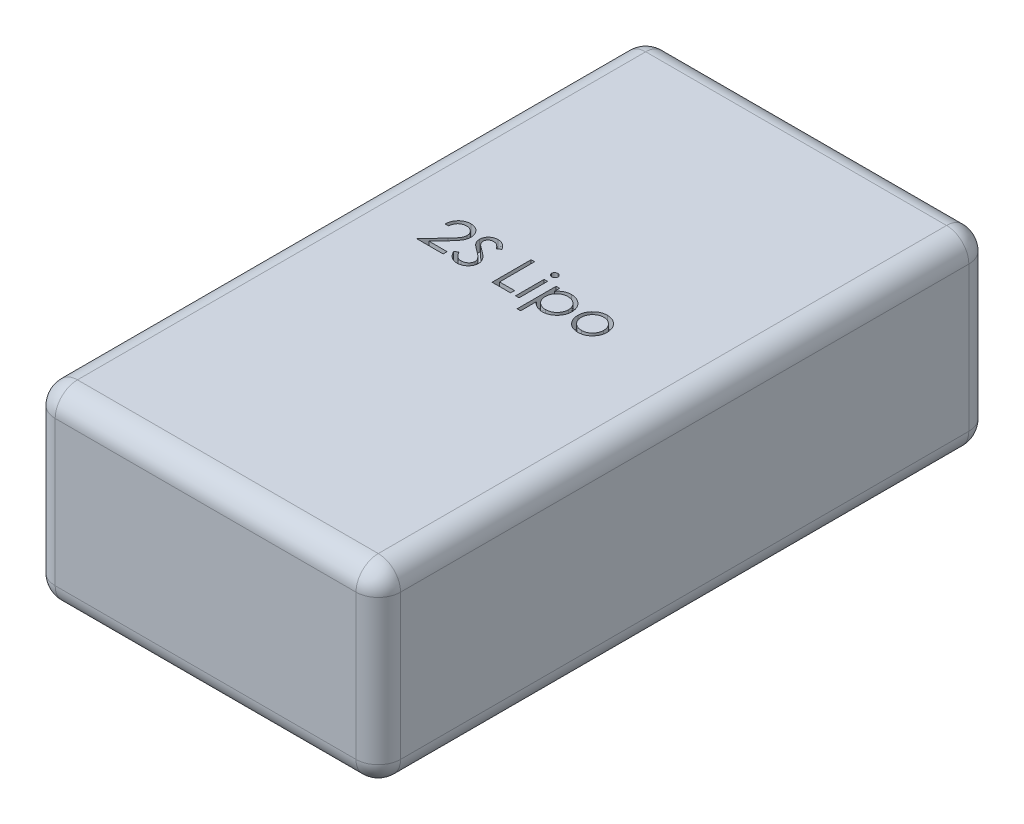
from build123d import *

# Parameters (mm, degrees)
SKETCH1_W           = 31
SKETCH1_H           = 55
BOSS_EXTRUDE1_DEPTH = 17
SKETCH2_W           = 0.314102564
SKETCH2_H           = 2.557692308
CUT_EXTRUDE1_DEPTH  = 1
FILLET1_R           = 2


with BuildPart() as part:
    # Sketch1 → Boss-Extrude1 (new body)
    with BuildSketch(Plane(origin=(0, 0, 0), x_dir=(1, 0, 0), z_dir=(0, 1, 0))):
        with Locations((15.5, -27.5)):
            Rectangle(SKETCH1_W, SKETCH1_H)
    extrude(amount=BOSS_EXTRUDE1_DEPTH)

    # Sketch2 → Cut-Extrude1 (cut)
    # profile 1 of 7: a face of its own
    with BuildSketch(Plane(origin=(0, 17, 0), x_dir=(1, 0, 0), z_dir=(0, 1, 0))):
        with BuildLine():
            Line((6.692234496, -24.382132974), (6.378131932, -24.382132974))
            add(Edge.make_bspline(
                [(6.378131932, -24.382132974), (6.380179085, -24.340462086), (6.384199639, -24.258621572), (6.403027928, -24.139297665), (6.429968806, -24.025242866), (6.46806026, -23.917372952), (6.515366537, -23.814734145), (6.572096565, -23.71773413), (6.639290415, -23.626742941), (6.715497149, -23.542604098), (6.798265788, -23.465416527), (6.887571728, -23.398761284), (6.981416755, -23.342443613), (7.079516154, -23.295362371), (7.182976718, -23.260022525), (7.290859576, -23.233800885), (7.403638712, -23.218024539), (7.480478734, -23.216328754), (7.519558214, -23.215466307)],
                knots=[0, 0, 0, 0, 1.10065271, 2.161652631, 3.183658789, 4.190468796, 5.17591951, 6.163126047, 7.15150782, 8.156236427, 9.156009102, 10.134482811, 11.092018607, 12.041330605, 13.001268258, 13.972401359, 14.968799086, 16, 16, 16, 16], degree=3))
            add(Edge.make_bspline(
                [(7.519558214, -23.215466307), (7.557936288, -23.216364764), (7.633347833, -23.218130198), (7.743409847, -23.233291228), (7.848187142, -23.257036819), (7.947474908, -23.290352236), (8.040480973, -23.335136663), (8.127904017, -23.388934202), (8.210784828, -23.451154033), (8.285391612, -23.524407847), (8.353899691, -23.602610231), (8.413001946, -23.686098135), (8.46361511, -23.77232742), (8.50580279, -23.861955622), (8.536858929, -23.95582665), (8.560437137, -24.052573853), (8.57376455, -24.153198664), (8.575809974, -24.22130522), (8.576849881, -24.255931051)],
                knots=[0, 0, 0, 0, 1.111607364, 2.184268762, 3.212621178, 4.221274766, 5.211760367, 6.196651075, 7.1921475, 8.207485113, 9.220403448, 10.201281604, 11.166441695, 12.114753415, 13.065576456, 14.026450734, 14.996634279, 16, 16, 16, 16], degree=3))
            add(Edge.make_bspline(
                [(8.576849881, -24.255931051), (8.575156618, -24.304678885), (8.571799807, -24.401319099), (8.54308543, -24.543333962), (8.498238919, -24.680927381), (8.444241562, -24.791664683), (8.389769118, -24.880898177), (8.34068161, -24.954366882), (8.283216799, -25.03347235), (8.216538301, -25.117949687), (8.142025429, -25.208460593), (8.059003266, -25.304950388), (7.966879784, -25.406422158), (7.902221283, -25.475727759), (7.868716868, -25.511640185)],
                knots=[0, 0, 0, 0, 1.184426356, 2.348067706, 3.509069118, 4.696110526, 5.333549288, 6.050745305, 6.844228056, 7.710549037, 8.667450064, 9.695053472, 10.805634456, 12, 12, 12, 12], degree=3))
            Line((7.868716868, -25.511640185), (6.993015746, -26.446235538))
            Line((6.993015746, -26.446235538), (8.621721676, -26.446235538))
            Line((8.621721676, -26.446235538), (8.621721676, -26.805209897))
            Line((8.621721676, -26.805209897), (6.243516548, -26.805209897))
            Line((6.243516548, -26.805209897), (7.600888342, -25.356692269))
            add(Edge.make_bspline(
                [(7.600888342, -25.356692269), (7.633936229, -25.322193962), (7.697414456, -25.255929776), (7.787197033, -25.159186815), (7.867836021, -25.069437275), (7.939853414, -24.986850726), (8.00168692, -24.910219158), (8.056559152, -24.842024455), (8.100524742, -24.779270005), (8.148240138, -24.706529391), (8.19445412, -24.617717073), (8.234166476, -24.509183384), (8.258381324, -24.397456132), (8.26128616, -24.321954095), (8.262747317, -24.283975923)],
                knots=[0, 0, 0, 0, 1.329631726, 2.553950428, 3.673215718, 4.687767853, 5.603093632, 6.413772471, 7.123043292, 7.734684054, 8.834405432, 9.900288307, 10.943827018, 12, 12, 12, 12], degree=3))
            add(Edge.make_bspline(
                [(8.262747317, -24.283975923), (8.262111574, -24.260094524), (8.260858648, -24.213028874), (8.249800951, -24.144023115), (8.233090445, -24.077458301), (8.209145187, -24.013129682), (8.177538447, -23.95168403), (8.139065067, -23.89304655), (8.094675003, -23.836357584), (8.043323734, -23.783204286), (7.986912214, -23.734523081), (7.927317965, -23.691398995), (7.86426786, -23.655359885), (7.798027738, -23.625816387), (7.728782269, -23.602641006), (7.656397524, -23.586582427), (7.581073507, -23.576499943), (7.529640012, -23.575135771), (7.503432413, -23.574440666)],
                knots=[0, 0, 0, 0, 0.991446411, 1.95395049, 2.89581595, 3.838931463, 4.798493298, 5.75982156, 6.748411868, 7.785213223, 8.824556874, 9.840280684, 10.836137867, 11.835679398, 12.848801643, 13.863922112, 14.911575587, 16, 16, 16, 16], degree=3))
            add(Edge.make_bspline(
                [(7.503432413, -23.574440666), (7.47606158, -23.575155698), (7.422309784, -23.576559904), (7.343390751, -23.586382568), (7.268104973, -23.603328408), (7.196263071, -23.626505083), (7.127743485, -23.655963631), (7.062879441, -23.692655376), (7.001816551, -23.736438869), (6.944440028, -23.786079426), (6.891576049, -23.841347027), (6.845129173, -23.90295699), (6.804545159, -23.969784405), (6.769135925, -24.041648956), (6.740380235, -24.119202736), (6.718407085, -24.202170441), (6.701020238, -24.290191822), (6.695211718, -24.350976907), (6.692234496, -24.382132974)],
                knots=[0, 0, 0, 0, 1.031018746, 2.02475058, 2.990194455, 3.934040569, 4.864654155, 5.795059489, 6.735614925, 7.690564532, 8.649604399, 9.611025574, 10.590972636, 11.591080095, 12.624614302, 13.701020113, 14.821632451, 16, 16, 16, 16], degree=3))
        make_face()
    # profile 2 of 7: a face of its own
    with BuildSketch(Plane(origin=(0, 17, 0), x_dir=(1, 0, 0), z_dir=(0, 1, 0))):
        with BuildLine():
            Line((8.890952445, -26.130029609), (9.186825842, -25.952645794))
            add(Edge.make_bspline(
                [(9.186825842, -25.952645794), (9.21434408, -25.998710179), (9.26706796, -26.086967763), (9.355019319, -26.206225804), (9.446152231, -26.30758796), (9.541141564, -26.390464568), (9.639407512, -26.455713455), (9.741591566, -26.501915686), (9.847349377, -26.530731662), (9.919323198, -26.534231748), (9.95525533, -26.535979128)],
                knots=[0, 0, 0, 0, 1.272034388, 2.437168799, 3.508375237, 4.49857839, 5.41946034, 6.295179144, 7.148887113, 8, 8, 8, 8], degree=3))
            add(Edge.make_bspline(
                [(9.95525533, -26.535979128), (9.98594219, -26.535124455), (10.046778963, -26.533430065), (10.136341206, -26.517149263), (10.223323008, -26.492137134), (10.305931646, -26.456316202), (10.383027261, -26.412977717), (10.450633956, -26.360631539), (10.509080069, -26.302025334), (10.556889184, -26.236642679), (10.593569219, -26.16632553), (10.621761287, -26.094149579), (10.637406361, -26.018981011), (10.639763115, -25.968370548), (10.640952445, -25.942830089)],
                knots=[0, 0, 0, 0, 1.095163259, 2.171163733, 3.241058638, 4.321873601, 5.38011039, 6.391990106, 7.366004449, 8.327778327, 9.272591725, 10.192022065, 11.087607919, 12, 12, 12, 12], degree=3))
            add(Edge.make_bspline(
                [(10.640952445, -25.942830089), (10.639478134, -25.91368924), (10.636481076, -25.85445015), (10.611149596, -25.767050497), (10.571300349, -25.680557927), (10.534537705, -25.627056662), (10.515451644, -25.59928041)],
                knots=[0, 0, 0, 0, 0.938893495, 1.908633276, 2.914225137, 4, 4, 4, 4], degree=3))
            add(Edge.make_bspline(
                [(10.515451644, -25.59928041), (10.499781029, -25.579233586), (10.466882535, -25.537147788), (10.410325023, -25.474502552), (10.343958908, -25.409884133), (10.270055353, -25.340825076), (10.185922265, -25.27053728), (10.09419475, -25.195669002), (9.992530891, -25.119067425), (9.921231395, -25.067694859), (9.884442028, -25.041187461)],
                knots=[0, 0, 0, 0, 0.722233717, 1.516239348, 2.393582979, 3.351407094, 4.387010283, 5.505090956, 6.712668013, 8, 8, 8, 8], degree=3))
            add(Edge.make_bspline(
                [(9.884442028, -25.041187461), (9.847618032, -25.014958873), (9.777213356, -24.964811811), (9.678754773, -24.890387527), (9.59071031, -24.822343658), (9.513471294, -24.760039646), (9.447071697, -24.703467041), (9.390988286, -24.653169102), (9.346649729, -24.607785541), (9.321994148, -24.578344199), (9.3109244, -24.565125762)],
                knots=[0, 0, 0, 0, 1.452282411, 2.77665338, 3.964542531, 5.026858415, 5.96415736, 6.766646006, 7.446254459, 8, 8, 8, 8], degree=3))
            add(Edge.make_bspline(
                [(9.3109244, -24.565125762), (9.295451855, -24.544524725), (9.265023018, -24.504010022), (9.224857013, -24.440685164), (9.19071785, -24.375861899), (9.163955518, -24.309366034), (9.141419299, -24.242131105), (9.126261368, -24.173279859), (9.116769971, -24.103121241), (9.115797985, -24.05590774), (9.115311419, -24.032273198)],
                knots=[0, 0, 0, 0, 1.068054152, 2.10047183, 3.106115577, 4.101338837, 5.06977816, 6.043150881, 7.020423561, 8, 8, 8, 8], degree=3))
            add(Edge.make_bspline(
                [(9.115311419, -24.032273198), (9.116616628, -23.995243424), (9.119199148, -23.92197536), (9.141039666, -23.81494453), (9.175512559, -23.712758112), (9.223807447, -23.616427779), (9.2860648, -23.528461798), (9.358110774, -23.447848311), (9.443922261, -23.380079728), (9.538074884, -23.32086767), (9.641131256, -23.274521745), (9.749122159, -23.239560765), (9.862219231, -23.219751507), (9.938822366, -23.216908742), (9.977691227, -23.215466307)],
                knots=[0, 0, 0, 0, 1.005424448, 1.989358655, 2.955360095, 3.929531133, 4.905563448, 5.876582895, 6.856512386, 7.866279853, 8.892233794, 9.918561126, 10.94386622, 12, 12, 12, 12], degree=3))
            add(Edge.make_bspline(
                [(9.977691227, -23.215466307), (10.018935327, -23.216888859), (10.100956679, -23.21971786), (10.221605895, -23.244315391), (10.337766611, -23.285016063), (10.431209876, -23.331204721), (10.504342637, -23.377336137), (10.56011537, -23.419355961), (10.616632821, -23.46773107), (10.674350876, -23.522590316), (10.732291535, -23.584437067), (10.791314987, -23.652847756), (10.851559256, -23.727404312), (10.890315116, -23.780628812), (10.910183214, -23.807914224)],
                knots=[0, 0, 0, 0, 1.286793592, 2.559021753, 3.825965368, 5.121522368, 5.803751409, 6.523245864, 7.299691795, 8.125521123, 9.008227632, 9.944561021, 10.946284179, 12, 12, 12, 12], degree=3))
            Line((10.910183214, -23.807914224), (10.626228887, -24.023158615))
            add(Edge.make_bspline(
                [(10.626228887, -24.023158615), (10.609082955, -24.001069924), (10.576063898, -23.958532271), (10.525934411, -23.898960956), (10.478685763, -23.844544476), (10.432135363, -23.797279348), (10.388741732, -23.754577215), (10.346624689, -23.718017458), (10.306390338, -23.687241863), (10.255673428, -23.654398303), (10.191955709, -23.621841799), (10.111971173, -23.594292721), (10.028384898, -23.577737659), (9.971455266, -23.575548771), (9.942635137, -23.574440666)],
                knots=[0, 0, 0, 0, 1.181633172, 2.275549214, 3.290209073, 4.226197932, 5.078386478, 5.862611352, 6.581680152, 7.217281963, 8.414376989, 9.595101626, 10.782541182, 12, 12, 12, 12], degree=3))
            add(Edge.make_bspline(
                [(9.942635137, -23.574440666), (9.906478615, -23.575652366), (9.836754167, -23.577989015), (9.737763931, -23.603509001), (9.648670006, -23.643690861), (9.572117441, -23.700005839), (9.508380464, -23.766726832), (9.462275005, -23.843505687), (9.434524841, -23.928288089), (9.431138561, -23.987429746), (9.429413983, -24.017549641)],
                knots=[0, 0, 0, 0, 1.14458467, 2.207223713, 3.21896685, 4.227309161, 5.202851033, 6.127160689, 7.046193047, 8, 8, 8, 8], degree=3))
            add(Edge.make_bspline(
                [(9.429413983, -24.017549641), (9.42980711, -24.036301119), (9.430594006, -24.073834739), (9.441568804, -24.12928616), (9.455668133, -24.1845975), (9.478010765, -24.239520083), (9.508856068, -24.295014442), (9.549361244, -24.352036179), (9.600374556, -24.411087888), (9.639451568, -24.449495262), (9.660083054, -24.469773198)],
                knots=[0, 0, 0, 0, 0.858281714, 1.717966888, 2.583508476, 3.4729293, 4.427298488, 5.488583878, 6.674047936, 8, 8, 8, 8], degree=3))
            add(Edge.make_bspline(
                [(9.660083054, -24.469773198), (9.667744426, -24.476610224), (9.685946093, -24.492853432), (9.719222019, -24.519445713), (9.763164817, -24.552248485), (9.816627019, -24.592835802), (9.88059438, -24.639917264), (9.955073936, -24.692890876), (10.039235469, -24.753476335), (10.098957385, -24.795833876), (10.130535778, -24.81823073)],
                knots=[0, 0, 0, 0, 0.420754252, 0.999615792, 1.744751191, 2.668019286, 3.750313428, 4.999500688, 6.413464383, 8, 8, 8, 8], degree=3))
            add(Edge.make_bspline(
                [(10.130535778, -24.81823073), (10.168521692, -24.84587209), (10.242076148, -24.899395752), (10.346733728, -24.979811432), (10.441627536, -25.0584592), (10.52709074, -25.134836807), (10.603967648, -25.2083649), (10.671405369, -25.279928081), (10.730091049, -25.349013653), (10.793270267, -25.437586229), (10.857828087, -25.546367313), (10.913269594, -25.679645552), (10.948227942, -25.813441872), (10.952799457, -25.903368709), (10.955055009, -25.947737942)],
                knots=[0, 0, 0, 0, 1.163667725, 2.253281268, 3.268753668, 4.215851969, 5.092017293, 5.902905408, 6.650798638, 7.335211899, 8.59617414, 9.77448103, 10.901945474, 12, 12, 12, 12], degree=3))
            add(Edge.make_bspline(
                [(10.955055009, -25.947737942), (10.954397871, -25.979116307), (10.953096356, -26.04126369), (10.938135442, -26.132518767), (10.916215777, -26.221149637), (10.883178543, -26.306060749), (10.842855385, -26.388805512), (10.791689137, -26.467213413), (10.732381452, -26.543019811), (10.664347687, -26.614203303), (10.589901785, -26.679549499), (10.51121809, -26.73767856), (10.428167817, -26.786146883), (10.341201501, -26.825697725), (10.250299164, -26.856631243), (10.15549138, -26.879044112), (10.056621869, -26.892799823), (9.989421387, -26.894227584), (9.95525533, -26.894953487)],
                knots=[0, 0, 0, 0, 0.983748083, 1.948392443, 2.894712957, 3.844097841, 4.80183111, 5.778335162, 6.776009319, 7.81870978, 8.863265674, 9.881300176, 10.883814829, 11.87499822, 12.874611388, 13.892143829, 14.928324115, 16, 16, 16, 16], degree=3))
            add(Edge.make_bspline(
                [(9.95525533, -26.894953487), (9.928819987, -26.894442305), (9.876282227, -26.89342638), (9.798572745, -26.884445099), (9.722433155, -26.871737996), (9.648818873, -26.851563926), (9.576781462, -26.827086949), (9.506634227, -26.796948616), (9.438343173, -26.760831415), (9.371525591, -26.71953639), (9.306351416, -26.671478645), (9.243431948, -26.615505149), (9.180702762, -26.553159644), (9.120015366, -26.482749081), (9.060142222, -26.405410998), (9.002263812, -26.320421814), (8.945182095, -26.228244461), (8.909366627, -26.163379375), (8.890952445, -26.130029609)],
                knots=[0, 0, 0, 0, 0.915332311, 1.819136955, 2.706846663, 3.586547465, 4.459518054, 5.340707479, 6.227863349, 7.133153174, 8.059268498, 9.028702269, 10.047606654, 11.120612155, 12.245963614, 13.433783089, 14.680604001, 16, 16, 16, 16], degree=3))
        make_face()
    # profile 3 of 7: a face of its own
    with BuildSketch(Plane(origin=(0, 17, 0), x_dir=(1, 0, 0), z_dir=(0, 1, 0))):
        Polygon((13.019157573, -23.305209897), (13.333260137, -23.305209897), (13.333260137, -26.446235538), (14.679413983, -26.446235538), (14.679413983, -26.805209897), (13.019157573, -26.805209897), align=None)
    # profile 4 of 7: a face of its own
    with BuildSketch(Plane(origin=(0, 17, 0), x_dir=(1, 0, 0), z_dir=(0, 1, 0))):
        with BuildLine():
            add(Edge.make_bspline(
                [(15.283780971, -23.170594512), (15.303272286, -23.171498665), (15.341440026, -23.173269169), (15.396633294, -23.188430646), (15.446890306, -23.214130331), (15.491468039, -23.248610012), (15.529719926, -23.289159456), (15.556500636, -23.336420424), (15.573713032, -23.387479063), (15.575791587, -23.423094152), (15.576849881, -23.441227525)],
                knots=[0, 0, 0, 0, 1.055194115, 2.066272739, 3.074728998, 4.095836921, 5.109056067, 6.073838105, 7.019297344, 8, 8, 8, 8], degree=3))
            add(Edge.make_bspline(
                [(15.576849881, -23.441227525), (15.575767721, -23.458890178), (15.573628419, -23.493807153), (15.556513931, -23.543980625), (15.529491693, -23.590584909), (15.491492567, -23.631055619), (15.446883806, -23.665516239), (15.396635021, -23.691220978), (15.341439572, -23.706381115), (15.303272133, -23.708151804), (15.283780971, -23.709056051)],
                knots=[0, 0, 0, 0, 0.96129708, 1.900370562, 2.859976407, 3.87933698, 4.906634145, 5.921202961, 6.938410037, 8, 8, 8, 8], degree=3))
            add(Edge.make_bspline(
                [(15.283780971, -23.709056051), (15.264512695, -23.708186331), (15.227009515, -23.706493534), (15.172642673, -23.690923516), (15.122814184, -23.665507443), (15.078149511, -23.631281258), (15.040919318, -23.590336361), (15.013820992, -23.544009067), (14.99674603, -23.493799912), (14.994601402, -23.458887746), (14.993516548, -23.441227525)],
                knots=[0, 0, 0, 0, 1.054934014, 2.053291228, 3.073705704, 4.106921865, 5.123545215, 6.088680038, 7.033164197, 8, 8, 8, 8], degree=3))
            add(Edge.make_bspline(
                [(14.993516548, -23.441227525), (14.994577634, -23.423096676), (14.996661675, -23.387486543), (15.013833791, -23.33639151), (15.040693599, -23.289410008), (15.078174163, -23.248384509), (15.122807623, -23.214139074), (15.172644368, -23.188728093), (15.227009067, -23.173156753), (15.264512543, -23.171464139), (15.283780971, -23.170594512)],
                knots=[0, 0, 0, 0, 0.98631895, 1.937192651, 2.907499808, 3.917963147, 4.944918757, 5.95915025, 6.951458133, 8, 8, 8, 8], degree=3))
        make_face()
    # profile 5 of 7: a face of its own
    with BuildSketch(Plane(origin=(0, 17, 0), x_dir=(1, 0, 0), z_dir=(0, 1, 0))):
        with Locations((15.285183214, -25.526363743)):
            Rectangle(SKETCH2_W, SKETCH2_H)
    # profile 6 of 7: a face of its own
    with BuildSketch(Plane(origin=(0, 17, 0), x_dir=(1, 0, 0), z_dir=(0, 1, 0))):
        with BuildLine():
            Line((16.205055009, -24.247517589), (16.519157573, -24.247517589))
            Line((16.519157573, -24.247517589), (16.519157573, -24.720774801))
            add(Edge.make_bspline(
                [(16.519157573, -24.720774801), (16.552515057, -24.677837067), (16.617338652, -24.594396174), (16.729063557, -24.486406045), (16.846990366, -24.395330742), (16.974153778, -24.323948209), (17.108577468, -24.270127397), (17.249709786, -24.230347947), (17.398748551, -24.206906472), (17.500645003, -24.204084811), (17.552611099, -24.202645794)],
                knots=[0, 0, 0, 0, 1.0828784, 2.104357462, 3.088488658, 4.04616522, 5.001424249, 5.969181776, 6.964304535, 8, 8, 8, 8], degree=3))
            add(Edge.make_bspline(
                [(17.552611099, -24.202645794), (17.598002702, -24.203958973), (17.68772159, -24.20655454), (17.819784819, -24.224127595), (17.946960203, -24.254245287), (18.068528257, -24.297646203), (18.185791322, -24.351301673), (18.297013422, -24.419018708), (18.403926977, -24.497424899), (18.503843166, -24.58765705), (18.596164534, -24.685285316), (18.676010715, -24.79030762), (18.744882619, -24.899270207), (18.800552916, -25.013862299), (18.844161263, -25.133181529), (18.875175941, -25.25770997), (18.893633584, -25.38698591), (18.896110036, -25.474888631), (18.897362701, -25.519352525)],
                knots=[0, 0, 0, 0, 1.041296284, 2.058176809, 3.050446431, 4.034000596, 5.01514041, 6.003636468, 7.015969324, 8.052561599, 9.08815499, 10.094063707, 11.074456064, 12.040834395, 13.011057502, 13.983766392, 14.980127149, 16, 16, 16, 16], degree=3))
            add(Edge.make_bspline(
                [(18.897362701, -25.519352525), (18.896137216, -25.564754834), (18.893720381, -25.654294738), (18.874975375, -25.785781835), (18.845018501, -25.912269209), (18.801960318, -26.033546473), (18.74631883, -26.149530124), (18.67861427, -26.26013652), (18.598727802, -26.365330223), (18.507426675, -26.463683123), (18.408373739, -26.554282436), (18.302496249, -26.633520506), (18.191437324, -26.700061881), (18.075765156, -26.755644841), (17.954489518, -26.797537025), (17.82817624, -26.827754826), (17.696894094, -26.846389321), (17.607592942, -26.848841464), (17.562426804, -26.850081692)],
                knots=[0, 0, 0, 0, 1.038740735, 2.04854663, 3.033179607, 4.009277356, 4.987731542, 5.972001279, 6.972200261, 8.005528982, 9.039189865, 10.040446548, 11.026516639, 11.997840187, 12.972163198, 13.956796175, 14.96660207, 16, 16, 16, 16], degree=3))
            add(Edge.make_bspline(
                [(17.562426804, -26.850081692), (17.511599232, -26.848786884), (17.411199876, -26.846229259), (17.264402205, -26.820309849), (17.123125354, -26.781572914), (16.988934529, -26.72487392), (16.860766716, -26.652618404), (16.739346911, -26.564508198), (16.624030158, -26.460727573), (16.5546214, -26.381995757), (16.519157573, -26.341768391)],
                knots=[0, 0, 0, 0, 1.014726462, 2.004382257, 2.969841629, 3.936926163, 4.907207904, 5.903978561, 6.929055279, 8, 8, 8, 8], degree=3))
            Line((16.519157573, -26.341768391), (16.519157573, -27.747517589))
            Line((16.519157573, -27.747517589), (16.205055009, -27.747517589))
            Line((16.205055009, -27.747517589), (16.205055009, -24.247517589))
        make_face()
        with BuildLine():
            add(Edge.make_bspline(
                [(17.549806612, -24.516748359), (17.514227049, -24.517388617), (17.444180061, -24.51864912), (17.341507842, -24.533623069), (17.242612415, -24.55536081), (17.148490463, -24.58827271), (17.058239847, -24.628671524), (16.972555682, -24.679153535), (16.891498114, -24.738805541), (16.815271084, -24.806484884), (16.746407791, -24.881059573), (16.685444863, -24.960647382), (16.634237557, -25.045147521), (16.591735537, -25.133772884), (16.559392255, -25.227218169), (16.536436535, -25.324951182), (16.522006182, -25.427078894), (16.520117245, -25.496634901), (16.519157573, -25.531972717)],
                knots=[0, 0, 0, 0, 1.05670511, 2.080379991, 3.077984906, 4.06214886, 5.038337365, 6.01289324, 7.01187578, 8.025460281, 9.038092164, 10.024533457, 11.000252242, 11.969694649, 12.940728589, 13.933144304, 14.949937299, 16, 16, 16, 16], degree=3))
            add(Edge.make_bspline(
                [(16.519157573, -25.531972717), (16.520748429, -25.57836083), (16.523865051, -25.669239071), (16.549202419, -25.802023193), (16.590437683, -25.927674849), (16.648966397, -26.045135886), (16.722913971, -26.153118721), (16.812012127, -26.249809327), (16.915454678, -26.334599918), (17.03152187, -26.406021172), (17.155944001, -26.464009238), (17.285729913, -26.505523449), (17.419094794, -26.531095677), (17.509263113, -26.534342496), (17.554714464, -26.535979128)],
                knots=[0, 0, 0, 0, 1.03728447, 2.032128127, 3.01272805, 3.987917167, 4.958271349, 5.931593992, 6.91984656, 7.941419022, 8.973179163, 9.983609215, 10.983593296, 12, 12, 12, 12], degree=3))
            add(Edge.make_bspline(
                [(17.554714464, -26.535979128), (17.599250232, -26.534422751), (17.687645725, -26.531333623), (17.817803847, -26.504595435), (17.944294485, -26.46375041), (18.064474657, -26.404190854), (18.177298145, -26.331200796), (18.279179699, -26.243640763), (18.368186612, -26.14215082), (18.444050967, -26.029142317), (18.505182453, -25.907966933), (18.551112693, -25.782585544), (18.577621266, -25.653440121), (18.581378054, -25.566442408), (18.583260137, -25.522858134)],
                knots=[0, 0, 0, 0, 1.00104056, 1.986885549, 2.97790532, 3.984399681, 4.995088187, 5.994304198, 6.996462723, 8.023150851, 9.048424203, 10.043036403, 11.019596776, 12, 12, 12, 12], degree=3))
            add(Edge.make_bspline(
                [(18.583260137, -25.522858134), (18.581805403, -25.479003145), (18.57890727, -25.391634841), (18.550360232, -25.262871938), (18.507460254, -25.136983962), (18.444901202, -25.017463413), (18.370699933, -24.90468933), (18.280952936, -24.805135451), (18.180336739, -24.717964778), (18.067647575, -24.645949368), (17.94670715, -24.588663873), (17.819392234, -24.546780234), (17.686348632, -24.521606485), (17.595720977, -24.518381979), (17.549806612, -24.516748359)],
                knots=[0, 0, 0, 0, 0.983928682, 1.960191568, 2.949917689, 3.96440592, 4.982380491, 5.975291189, 6.965713506, 7.964880129, 8.970154049, 9.96478489, 10.968906225, 12, 12, 12, 12], degree=3))
        make_face(mode=Mode.SUBTRACT)
    # profile 7 of 7: a face of its own
    with BuildSketch(Plane(origin=(0, 17, 0), x_dir=(1, 0, 0), z_dir=(0, 1, 0))):
        with BuildLine():
            add(Edge.make_bspline(
                [(20.760944432, -24.202645794), (20.808935705, -24.203667686), (20.903034863, -24.205671364), (21.040842748, -24.22708633), (21.172387884, -24.259833694), (21.298174077, -24.305105256), (21.416590372, -24.365787207), (21.529361616, -24.438196498), (21.636178625, -24.523979092), (21.700201654, -24.59033716), (21.73269924, -24.624019993)],
                knots=[0, 0, 0, 0, 1.054011418, 2.066658804, 3.057071809, 4.030435133, 4.997543892, 5.974964718, 6.972108034, 8, 8, 8, 8], degree=3))
            add(Edge.make_bspline(
                [(21.73269924, -24.624019993), (21.760681194, -24.656233979), (21.816103574, -24.720038521), (21.887169293, -24.823494134), (21.948390853, -24.930634235), (21.997453814, -25.042881561), (22.036138838, -25.159256233), (22.063604534, -25.280158244), (22.079941469, -25.405320591), (22.082144436, -25.490324429), (22.083260137, -25.533374961)],
                knots=[0, 0, 0, 0, 1.025258237, 2.030674902, 3.01204498, 3.988269485, 4.97094183, 5.956517959, 6.965070386, 8, 8, 8, 8], degree=3))
            add(Edge.make_bspline(
                [(22.083260137, -25.533374961), (22.0822788, -25.576675019), (22.080339632, -25.662237952), (22.061996015, -25.788257318), (22.033464929, -25.910452141), (21.992633091, -26.028310834), (21.940274982, -26.142193662), (21.876384294, -26.251603211), (21.800512677, -26.356755344), (21.71450868, -26.456757183), (21.619456804, -26.548923397), (21.516340656, -26.629251667), (21.407186622, -26.698073191), (21.290543269, -26.753509607), (21.167475782, -26.797219307), (21.037718714, -26.827919324), (20.901473644, -26.846481007), (20.808446422, -26.848864581), (20.760944432, -26.850081692)],
                knots=[0, 0, 0, 0, 0.998656419, 1.973391657, 2.932242238, 3.890759089, 4.846373663, 5.82037756, 6.809684879, 7.83454468, 8.860553229, 9.859544525, 10.845671541, 11.83227036, 12.833544569, 13.85385346, 14.904124723, 16, 16, 16, 16], degree=3))
            add(Edge.make_bspline(
                [(20.760944432, -26.850081692), (20.713209713, -26.848860496), (20.619718853, -26.846468721), (20.482992871, -26.827991438), (20.353003252, -26.797233456), (20.229774654, -26.753365963), (20.112629807, -26.698071419), (20.00284331, -26.62945973), (19.899643394, -26.548899575), (19.80457141, -26.456763637), (19.718572804, -26.356753681), (19.642699796, -26.251603643), (19.57880947, -26.142193549), (19.526451266, -26.028310864), (19.485619453, -25.910452132), (19.45708836, -25.78825732), (19.438744746, -25.662237952), (19.436805577, -25.576675019), (19.43582424, -25.533374961)],
                knots=[0, 0, 0, 0, 1.099876186, 2.154163076, 3.173186993, 4.173200201, 5.163417411, 6.152872554, 7.150605724, 8.17532212, 9.198891216, 10.186952605, 11.159729845, 12.11414092, 13.071450619, 14.029093627, 15.002601286, 16, 16, 16, 16], degree=3))
            add(Edge.make_bspline(
                [(19.43582424, -25.533374961), (19.43694755, -25.490558415), (19.439171512, -25.405789013), (19.455492021, -25.280861952), (19.482850577, -25.160164563), (19.521581974, -25.044239087), (19.571097165, -24.932483651), (19.631458452, -24.82507882), (19.703249085, -24.72209102), (19.758451037, -24.65836894), (19.786385137, -24.626123359)],
                knots=[0, 0, 0, 0, 1.031353054, 2.041901799, 3.029428768, 4.008703097, 4.981709435, 5.96992636, 6.972712378, 8, 8, 8, 8], degree=3))
            add(Edge.make_bspline(
                [(19.786385137, -24.626123359), (19.818833728, -24.592148419), (19.882649592, -24.525330723), (19.98999832, -24.439798199), (20.102492141, -24.365882125), (20.222217067, -24.30640591), (20.347899925, -24.259567392), (20.480119168, -24.227001877), (20.618394683, -24.205748522), (20.712954304, -24.203690344), (20.760944432, -24.202645794)],
                knots=[0, 0, 0, 0, 1.027980169, 2.021703884, 2.998553061, 3.971491411, 4.943284454, 5.930300938, 6.949603206, 8, 8, 8, 8], degree=3))
        make_face()
        with BuildLine():
            add(Edge.make_bspline(
                [(20.759542189, -24.516748359), (20.725604577, -24.51771295), (20.658605449, -24.519617233), (20.559985864, -24.534101137), (20.46504571, -24.557048642), (20.373604866, -24.589652698), (20.285971693, -24.631751597), (20.202062291, -24.683459957), (20.121629851, -24.744092913), (20.046247788, -24.813555585), (19.977065476, -24.88943458), (19.916587499, -24.970282938), (19.865162393, -25.054789285), (19.822322234, -25.143041496), (19.790415046, -25.23593391), (19.767242023, -25.332414541), (19.752771783, -25.432679957), (19.750885404, -25.500840976), (19.749926804, -25.535478326)],
                knots=[0, 0, 0, 0, 1.021534396, 2.016698045, 2.994645724, 3.958388632, 4.93408049, 5.916473867, 6.921342795, 7.962252576, 8.998418191, 10.008913653, 10.997312074, 11.973003931, 12.956656626, 13.948281152, 14.957379055, 16, 16, 16, 16], degree=3))
            add(Edge.make_bspline(
                [(19.749926804, -25.535478326), (19.751533628, -25.580230354), (19.754722872, -25.669054759), (19.780658108, -25.799865882), (19.824044388, -25.925447734), (19.882631668, -26.04506412), (19.956037887, -26.155736398), (20.042524953, -26.254407882), (20.141164654, -26.339593694), (20.250781154, -26.410274539), (20.369135472, -26.466434295), (20.494391793, -26.506233271), (20.625032487, -26.532104963), (20.714313218, -26.534676437), (20.759542189, -26.535979128)],
                knots=[0, 0, 0, 0, 1.016792936, 2.018143844, 3.017858371, 4.030088057, 5.03801393, 6.028138512, 7.003788237, 7.991172063, 8.984598303, 9.972568034, 10.972917682, 12, 12, 12, 12], degree=3))
            add(Edge.make_bspline(
                [(20.759542189, -26.535979128), (20.804768557, -26.534668847), (20.894044153, -26.532082391), (21.02450333, -26.506363571), (21.149417302, -26.46625991), (21.26764869, -26.4103377), (21.377215293, -26.339325286), (21.476564414, -26.254888908), (21.562313026, -26.155475057), (21.63564663, -26.044917528), (21.695193373, -25.925633176), (21.738376575, -25.799842704), (21.764374161, -25.669060662), (21.76755499, -25.580232331), (21.769157573, -25.535478326)],
                knots=[0, 0, 0, 0, 1.02726834, 2.027799167, 3.010890988, 4.004497153, 4.992059811, 5.971914811, 6.958719428, 7.966827853, 8.981595046, 9.981490638, 10.983022906, 12, 12, 12, 12], degree=3))
            add(Edge.make_bspline(
                [(21.769157573, -25.535478326), (21.768199303, -25.500840769), (21.766313574, -25.432679343), (21.75183861, -25.332416889), (21.72868307, -25.235925293), (21.696711453, -25.14307329), (21.654057439, -25.054560785), (21.601640646, -24.970531058), (21.54140962, -24.889154512), (21.471392499, -24.813800871), (21.396089122, -24.744065835), (21.315624083, -24.683436445), (21.231839105, -24.63197885), (21.144460522, -24.589292609), (21.053007955, -24.557345269), (20.958200825, -24.533968637), (20.860002015, -24.519678441), (20.793242972, -24.517731299), (20.759542189, -24.516748359)],
                knots=[0, 0, 0, 0, 1.042956736, 2.052379634, 3.044323526, 4.02829302, 5.004299113, 5.996692471, 7.007513377, 8.048758398, 9.090003419, 10.095195979, 11.07790575, 12.047570684, 13.018257071, 13.989683339, 14.985167495, 16, 16, 16, 16], degree=3))
        make_face(mode=Mode.SUBTRACT)
    extrude(amount=-CUT_EXTRUDE1_DEPTH, mode=Mode.SUBTRACT)

    # Fillet1
    fillet1_edges = [part.edges().sort_by_distance(p)[0] for p in [
        (15.5, 17, 55),
        (0, 17, 27.5),
        (15.5, 17, 0),
        (0, 0, 27.5),
        (15.5, 0, 55),
        (31, 0, 27.5),
        (15.5, 0, 0),
        (0, 8.5, 0),
        (0, 8.5, 55),
        (31, 8.5, 55),
        (31, 8.5, 0),
        (31, 17, 27.5),
    ]]
    fillet(fillet1_edges, radius=FILLET1_R)


solid = part.part
